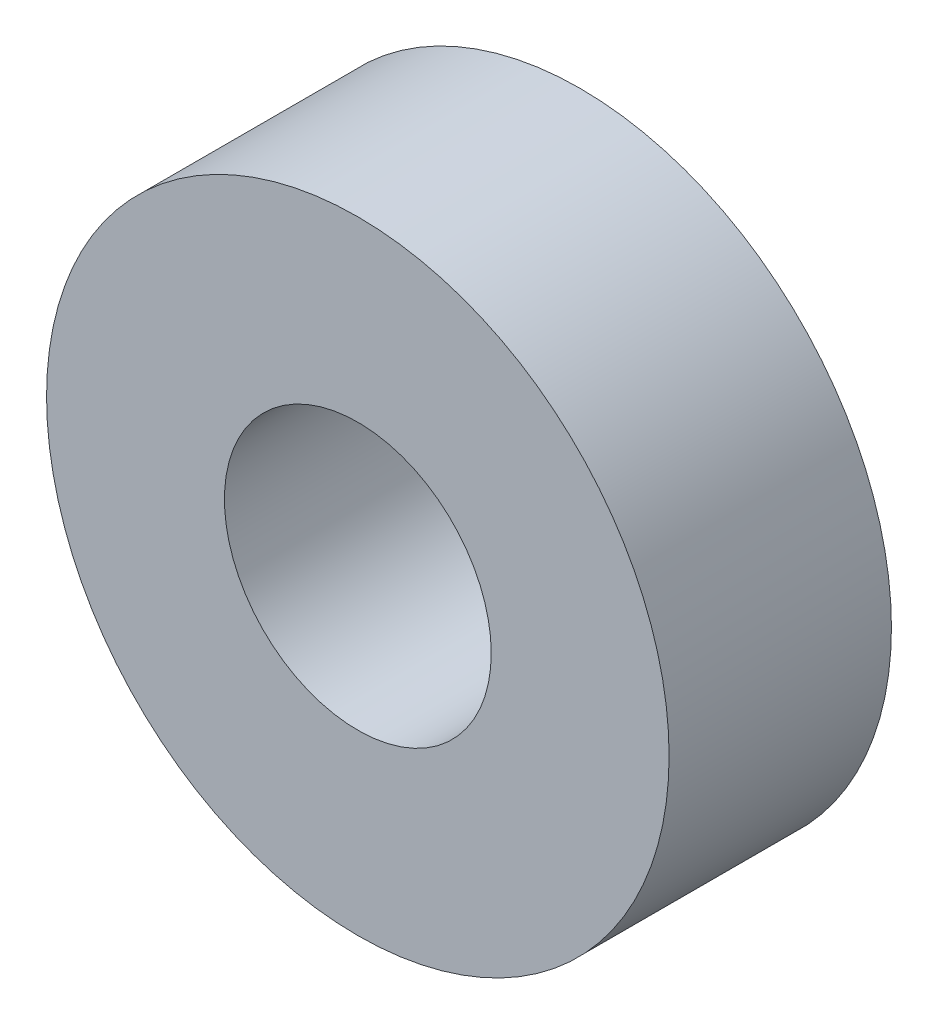
from build123d import *

# Parameters (mm, degrees)
ESQUISSE1_R        = 7
ESQUISSE1_R_2      = 3
BOSS_EXTRU_1_DEPTH = 5


with BuildPart() as part:
    # Esquisse1 → Boss.-Extru.1 (new body)
    with BuildSketch(Plane.XY):
        Circle(ESQUISSE1_R)
        Circle(ESQUISSE1_R_2, mode=Mode.SUBTRACT)
    extrude(amount=BOSS_EXTRU_1_DEPTH)


solid = part.part
